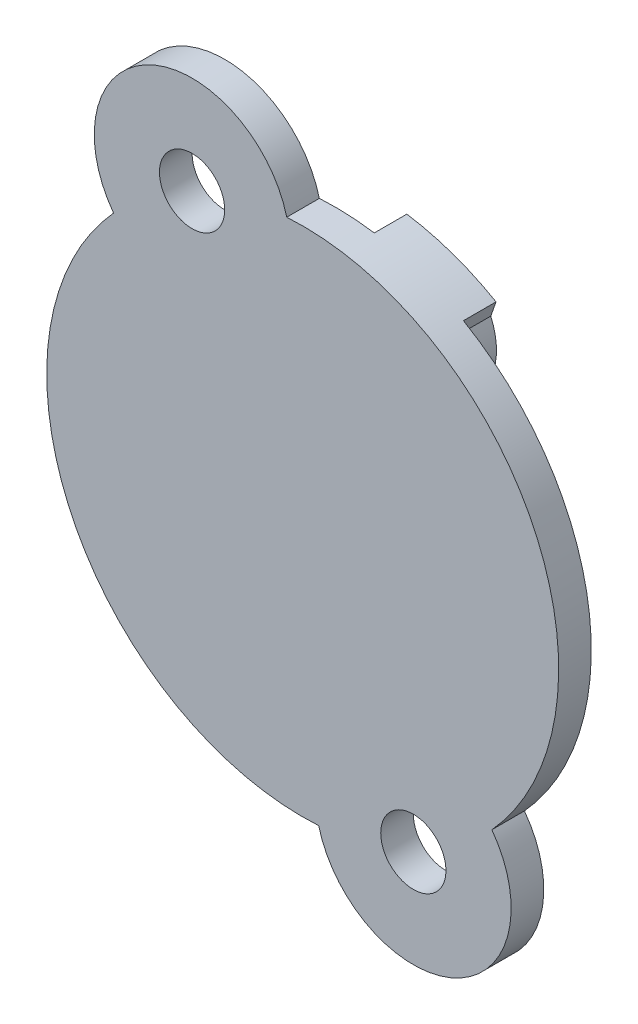
from build123d import *
from build123d.topology import SkipClean

# Parameters (mm, degrees)
SKETCH1_R           = 7.85
BOSS_EXTRUDE1_DEPTH = 1
BOSS_EXTRUDE2_START = 1
SKETCH3_R           = 6
SKETCH3_R_2         = 4.5
BOSS_EXTRUDE2_DEPTH = 1
BOSS_EXTRUDE3_DEPTH = 1
SKETCH2_3_R         = 1
CUT_EXTRUDE1_DEPTH  = 2
SKETCH2_4_R         = 1
CUT_EXTRUDE2_DEPTH  = 3


with BuildPart() as part:
    # Sketch1 → Boss-Extrude1 (new body)
    with BuildSketch(Plane.XY):
        Circle(SKETCH1_R)
    extrude(amount=BOSS_EXTRUDE1_DEPTH)

    # Sketch3 → Boss-Extrude2 (add)
    # profile 1 of 3: a face of its own
    with SkipClean():  # the faces are left unmerged after this step: merging them gives an invalid solid
        with BuildSketch(Plane(origin=(0, 0, 0), x_dir=(-1, 0, 0), z_dir=(0, 0, -1)).offset(BOSS_EXTRUDE2_START)):
            Circle(SKETCH3_R)
            Circle(SKETCH3_R_2, mode=Mode.SUBTRACT)
        # profile 2 of 3: a face of its own
        with BuildSketch(Plane(origin=(0, 0, 0), x_dir=(-1, 0, 0), z_dir=(0, 0, -1)).offset(BOSS_EXTRUDE2_START)):
            with BuildLine():
                ThreePointArc((3.757317387, -4.677880508), (1.992185075, -5.659611173), (0.001300165, -5.999999859))
                ThreePointArc((0.001300165, -5.999999859), (0.375700996, -6.761308528), (1.032012818, -7.298915878))
                Line((1.032012818, -7.298915878), (1.193852248, -7.758686539))
                ThreePointArc((1.193852248, -7.758686539), (2.606442139, -7.404657951), (3.929330982, -6.795797086))
                Line((3.929330982, -6.795797086), (3.767491551, -6.336026426))
                ThreePointArc((3.767491551, -6.336026426), (3.9423428, -5.505849389), (3.757317387, -4.677880508))
            make_face()
        # profile 3 of 3: a face of its own
        with BuildSketch(Plane(origin=(0, 0, 0), x_dir=(-1, 0, 0), z_dir=(0, 0, -1)).offset(BOSS_EXTRUDE2_START)):
            with BuildLine():
                Line((-3.929330982, 6.795797086), (-3.767491551, 6.336026426))
                ThreePointArc((-3.767491551, 6.336026426), (-3.9423428, 5.505849389), (-3.757317387, 4.677880508))
                ThreePointArc((-3.757317387, 4.677880508), (-1.992185075, 5.659611173), (-0.001300165, 5.999999859))
                ThreePointArc((-0.001300165, 5.999999859), (-0.375700996, 6.761308528), (-1.032012818, 7.298915878))
                Line((-1.032012818, 7.298915878), (-1.193852248, 7.758686539))
                ThreePointArc((-1.193852248, 7.758686539), (-2.606442139, 7.404657951), (-3.929330982, 6.795797086))
            make_face()
        extrude(amount=-BOSS_EXTRUDE2_DEPTH)

    # Sketch2 → Boss-Extrude3 (add)
    with BuildSketch(Plane(origin=(0, 0, 0), x_dir=(-1, 0, 0), z_dir=(0, 0, -1))):
        with BuildLine():
            ThreePointArc((-4.265263368, -6.590146311), (-5.074768612, -5.989092046), (-5.800557161, -5.289237811))
            ThreePointArc((-5.800557161, -5.289237811), (-4.68948187, -9.784235269), (-0.489616971, -7.834716027))
            ThreePointArc((-0.489616971, -7.834716027), (-1.489786667, -7.707336485), (-2.46537987, -7.452811691))
            ThreePointArc((-2.46537987, -7.452811691), (-3.825061249, -7.980689597), (-4.265263368, -6.590146311))
        make_face()
        with BuildLine():
            ThreePointArc((2.46537987, 7.452811691), (3.583283252, 8.060617089), (4.392850938, 7.078916761))
            ThreePointArc((4.392850938, 7.078916761), (4.360428436, 6.826342445), (4.265263368, 6.590146311))
            ThreePointArc((4.265263368, 6.590146311), (5.074768612, 5.989092046), (5.800557161, 5.289237811))
            ThreePointArc((5.800557161, 5.289237811), (4.68948187, 9.784235269), (0.489616971, 7.834716027))
            ThreePointArc((0.489616971, 7.834716027), (1.489786667, 7.707336485), (2.46537987, 7.452811691))
        make_face()
    extrude(amount=-BOSS_EXTRUDE3_DEPTH)

    # Sketch2<3> → Cut-Extrude1 (cut)
    with BuildSketch(Plane(origin=(0, 0, 0), x_dir=(-1, 0, 0), z_dir=(0, 0, -1))):
        with Locations((3.392850938, 7.078916761)):
            Circle(SKETCH2_3_R)
    extrude(amount=-CUT_EXTRUDE1_DEPTH, mode=Mode.SUBTRACT)

    # Sketch2<4> → Cut-Extrude2 (cut)
    with BuildSketch(Plane(origin=(0, 0, 0), x_dir=(-1, 0, 0), z_dir=(0, 0, -1))):
        with Locations((-3.392850938, -7.078916761)):
            Circle(SKETCH2_4_R)
    extrude(amount=-CUT_EXTRUDE2_DEPTH, mode=Mode.SUBTRACT)


solid = part.part
